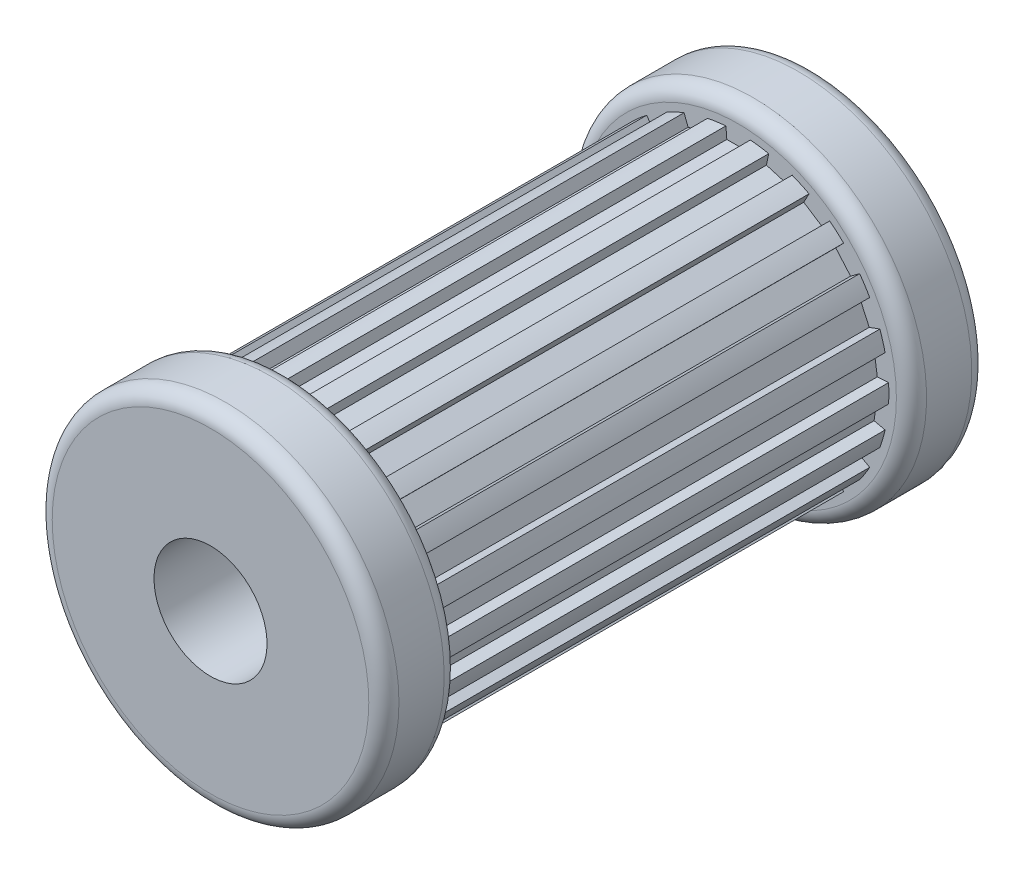
from build123d import *

# Parameters (mm, degrees)
SKETCH1_R           = 20
BOSS_EXTRUDE1_DEPTH = 70
CUT_EXTRUDE1_DEPTH  = 76.498344353
CIRPATTERN1_COUNT   = 22
SKETCH3_R           = 23
BOSS_EXTRUDE2_DEPTH = 10
SKETCH4_R           = 23
BOSS_EXTRUDE3_DEPTH = 10
SKETCH5_R           = 7.5
CUT_EXTRUDE2_DEPTH  = 87.35971283
FILLET1_R           = 2


with BuildPart() as part:
    # Sketch1 → Boss-Extrude1 (new body)
    with BuildSketch(Plane.XY):
        Circle(SKETCH1_R)
    extrude(amount=BOSS_EXTRUDE1_DEPTH)

    # Sketch2 → Cut-Extrude1 (cut, through all)
    with BuildSketch(Plane.XY.offset(70)):
        with BuildLine():
            Line((-1.5, 18.439088915), (1.5, 18.439088915))
            Line((1.5, 18.439088915), (1.621621622, 19.934150178))
            ThreePointArc((1.621621622, 19.934150178), (0, 20), (-1.621621622, 19.934150178))
            Line((-1.621621622, 19.934150178), (-1.5, 18.439088915))
        make_face()
    cut_extrude1 = extrude(amount=-CUT_EXTRUDE1_DEPTH, mode=Mode.SUBTRACT)

    # CirPattern1: Cut-Extrude1 ×22 about axis
    cirpattern1_axis = Axis((0, 0, 0), (0, 0, 1))
    for i in range(1, CIRPATTERN1_COUNT):
        add(cut_extrude1.rotate(cirpattern1_axis, i * 360 / CIRPATTERN1_COUNT), mode=Mode.SUBTRACT)

    # Sketch3 → Boss-Extrude2 (add)
    with BuildSketch(Plane.XY.offset(70)):
        Circle(SKETCH3_R)
    extrude(amount=-BOSS_EXTRUDE2_DEPTH)

    # Sketch4 → Boss-Extrude3 (add)
    with BuildSketch(Plane(origin=(0, 0, 0), x_dir=(-1, 0, 0), z_dir=(0, 0, -1))):
        with Locations(Location((0, 0, 0), (0, 0, 180))):
            Circle(SKETCH4_R)
    extrude(amount=BOSS_EXTRUDE3_DEPTH)

    # Sketch5 → Cut-Extrude2 (cut, through all)
    with BuildSketch(Plane(origin=(0, 0, -10), x_dir=(-1, 0, 0), z_dir=(0, 0, -1))):
        Circle(SKETCH5_R)
    extrude(amount=-CUT_EXTRUDE2_DEPTH, mode=Mode.SUBTRACT)

    # Fillet1
    fillet1_edges = [part.edges().sort_by_distance(p)[0] for p in [
        (-23, 0, 70),
        (-23, 0, 60),
        (-23, 0, 0),
        (-23, 0, -10),
    ]]
    fillet(fillet1_edges, radius=FILLET1_R)


solid = part.part
